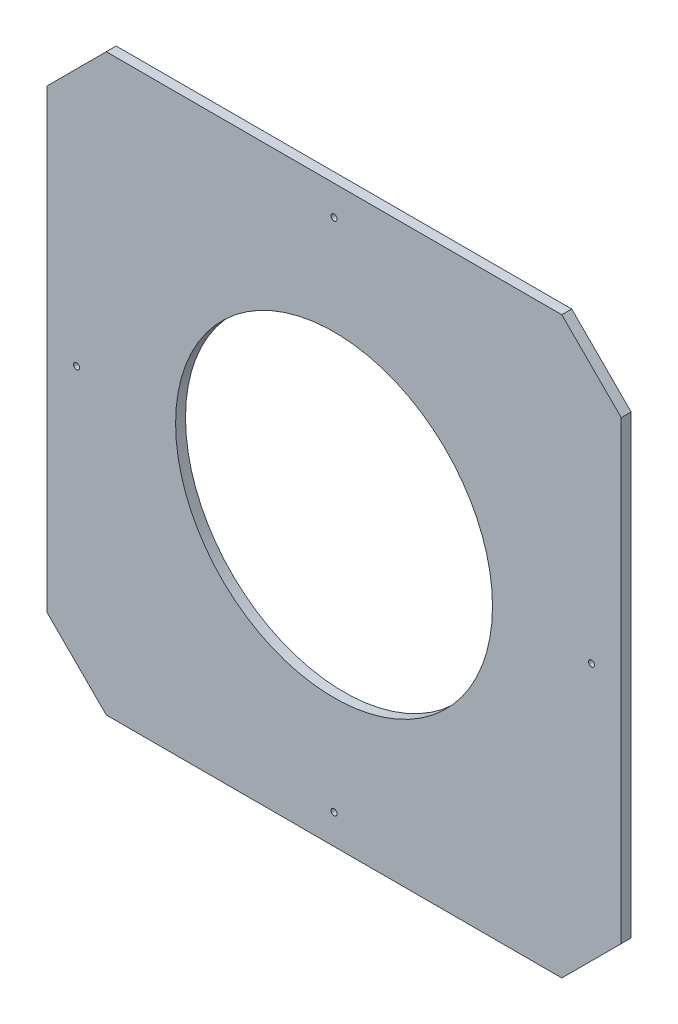
from build123d import *

# Parameters (mm, degrees)
SKETCH1_R                       = 80
BOSS_EXTRUDE1_DEPTH             = 5
F_3_0MM_DOWEL_HOLE1_D           = 3
F_3_0MM_DOWEL_HOLE1_DEPTH       = 7.5
F_3_0MM_DOWEL_HOLE1_CSINK_D     = 3.05
F_3_0MM_DOWEL_HOLE1_CSINK_ANGLE = 90
F_3_0MM_DOWEL_HOLE1_TIP         = 0.901290929


with BuildPart() as part:
    # Sketch1 → Boss-Extrude1 (new body)
    with BuildSketch(Plane.XY):
        Polygon((-145, 115), (-115, 145), (115, 145), (145, 115), (145, -115), (115, -145), (-115, -145), (-145, -115), align=None)
        Circle(SKETCH1_R, mode=Mode.SUBTRACT)
    extrude(amount=BOSS_EXTRUDE1_DEPTH)

    # Ø3.0mm Dowel Hole1
    with Locations(Plane.XY.offset(5)):
        with Locations((0, 130), (130, 0), (0, -130), (-130, 0)):
            CounterSinkHole(F_3_0MM_DOWEL_HOLE1_D / 2, F_3_0MM_DOWEL_HOLE1_CSINK_D / 2, depth=F_3_0MM_DOWEL_HOLE1_DEPTH, counter_sink_angle=F_3_0MM_DOWEL_HOLE1_CSINK_ANGLE)
            with Locations((0, 0, -(F_3_0MM_DOWEL_HOLE1_DEPTH + F_3_0MM_DOWEL_HOLE1_TIP / 2))):  # 118° drill point
                Cone(0, F_3_0MM_DOWEL_HOLE1_D / 2, F_3_0MM_DOWEL_HOLE1_TIP, mode=Mode.SUBTRACT)


solid = part.part
